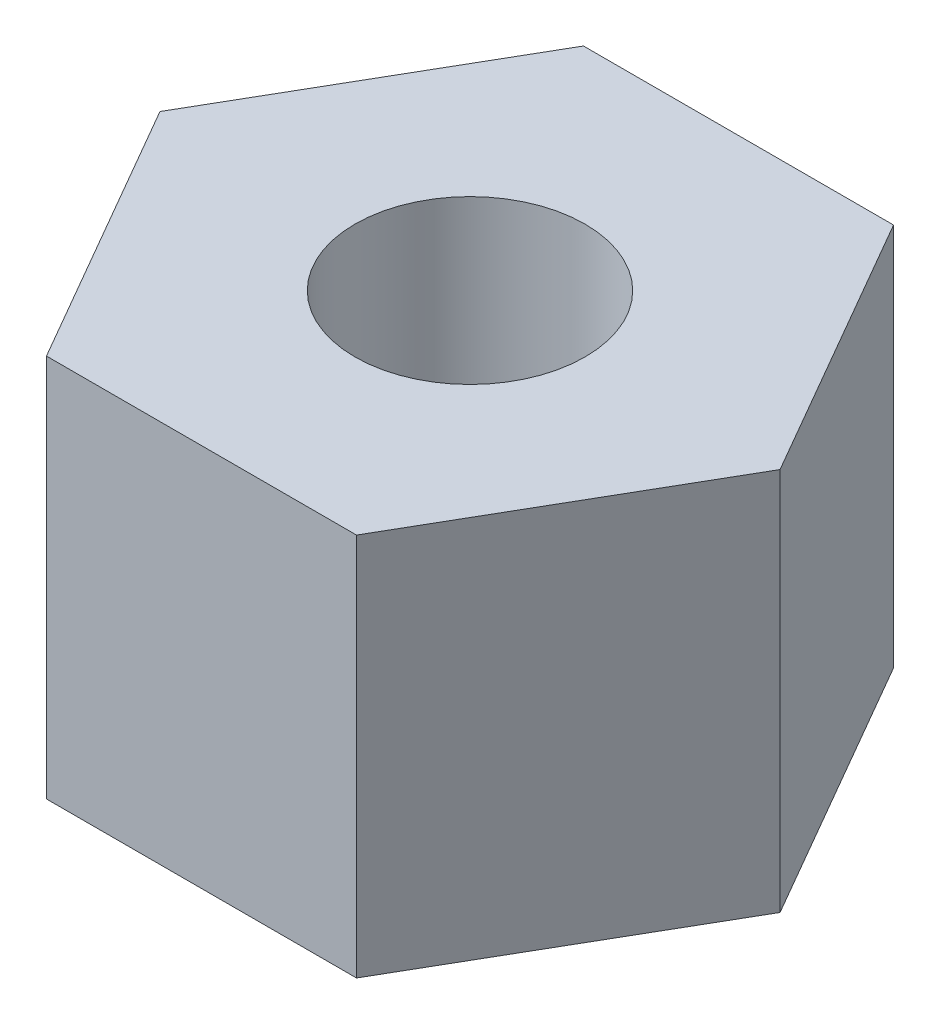
from build123d import *

# Parameters (mm, degrees)
CROQUIS1_R              = 1.5
SALIENTE_EXTRUIR1_DEPTH = 2.5


with BuildPart() as part:
    # Croquis1 → Saliente-Extruir1 (new, symmetric)
    with BuildSketch(Plane(origin=(0, 0, 0), x_dir=(1, 0, 0), z_dir=(0, 1, 0))):
        Polygon((-2.020725942, -3.5), (2.020725942, -3.5), (4.041451884, 0), (2.020725942, 3.5), (-2.020725942, 3.5), (-4.041451884, 0), align=None)
        with Locations(Location((0, 0, 0), (0, 0, 270))):
            Circle(CROQUIS1_R, mode=Mode.SUBTRACT)
    extrude(amount=SALIENTE_EXTRUIR1_DEPTH, both=True)


solid = part.part
